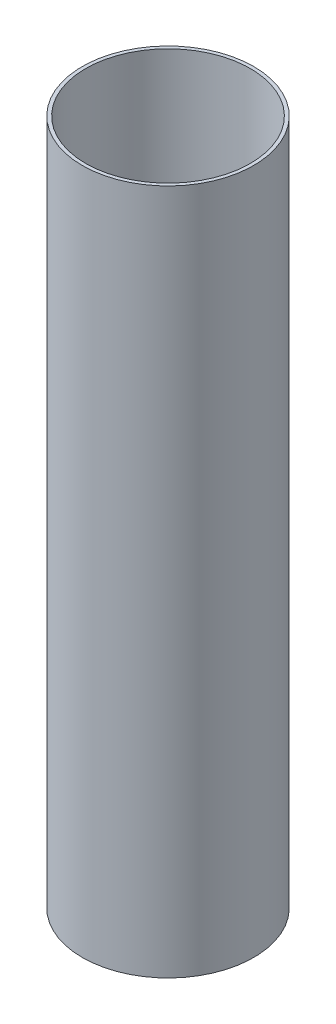
from build123d import *

# Parameters (mm, degrees)
SKETCH1_R           = 50
SKETCH1_R_2         = 48
BOSS_EXTRUDE1_DEPTH = 400


with BuildPart() as part:
    # Sketch1 → Boss-Extrude1 (new body)
    with BuildSketch(Plane(origin=(0, 0, 0), x_dir=(1, 0, 0), z_dir=(0, 1, 0))):
        with Locations(Location((0, 0, 0), (0, 0, 270))):
            Circle(SKETCH1_R)
        with Locations(Location((0, 0, 0), (0, 0, 270))):
            Circle(SKETCH1_R_2, mode=Mode.SUBTRACT)
    extrude(amount=BOSS_EXTRUDE1_DEPTH)


solid = part.part
